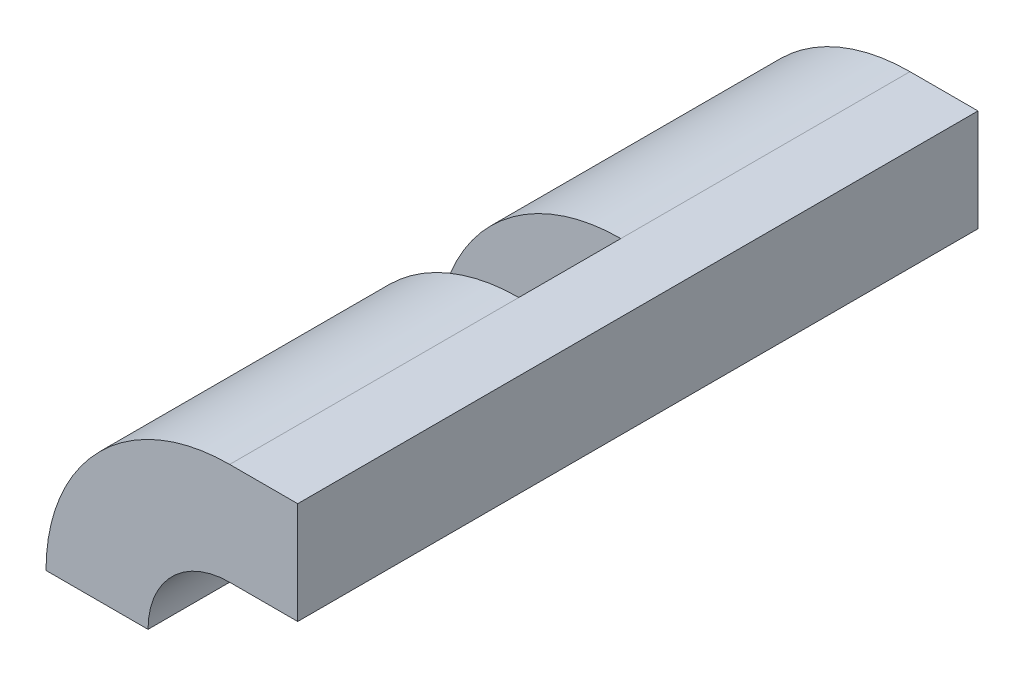
from build123d import *

# Parameters (mm, degrees)
EXTRUDE_1_DEPTH     = 200
SKETCH_2_W          = 30
SKETCH_2_H          = 58.023889151
CUT_EXTRUDE_1_DEPTH = 54


with BuildPart() as part:
    # 草图1 → 凸台-拉伸1 (new body)
    with BuildSketch(Plane.XY):
        with BuildLine():
            Line((-74, -24), (-44, -24))
            ThreePointArc((-44, -24), (-36.970562748, -7.029437252), (-20, 0))
            Line((-20, 0), (0, 0))
            Line((0, 0), (0, 30))
            Line((0, 30), (-20, 30))
            ThreePointArc((-20, 30), (-58.183766184, 14.183766184), (-74, -24))
        make_face()
    extrude(amount=EXTRUDE_1_DEPTH)

    # 草图2 → 切除-拉伸1 (cut)
    with BuildSketch(Plane.ZY.offset(74)):
        with Locations((100, 5.011944575)):
            Rectangle(SKETCH_2_W, SKETCH_2_H)
    extrude(amount=-CUT_EXTRUDE_1_DEPTH, mode=Mode.SUBTRACT)


solid = part.part
